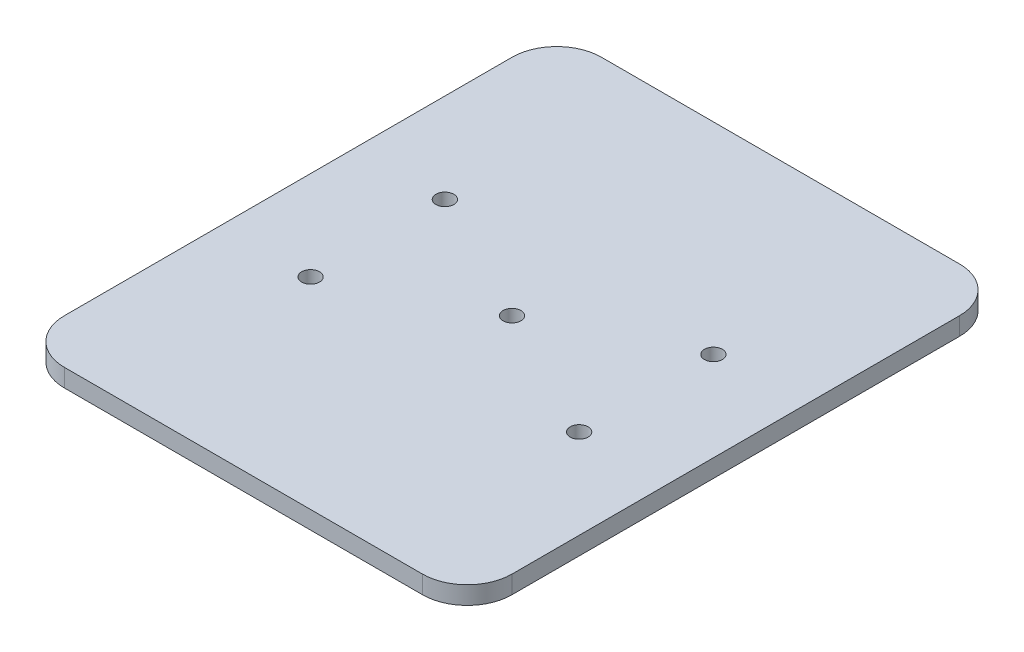
from build123d import *

# Parameters (mm, degrees)
SKETCH1_R           = 1
BOSS_EXTRUDE1_DEPTH = 2


with BuildPart() as part:
    # Sketch1 → Boss-Extrude1 (new body)
    with BuildSketch(Plane(origin=(0, 0, 0), x_dir=(1, 0, 0), z_dir=(0, 1, 0))):
        with BuildLine():
            Line((-52.254901961, 26.274509804), (-12.254901961, 26.274509804))
            ThreePointArc((-12.254901961, 26.274509804), (-8.719368055, 24.81004371), (-7.254901961, 21.274509804))
            Line((-7.254901961, 21.274509804), (-7.254901961, -28.725490196))
            ThreePointArc((-7.254901961, -28.725490196), (-8.719368055, -32.261024102), (-12.254901961, -33.725490196))
            Line((-12.254901961, -33.725490196), (-52.254901961, -33.725490196))
            ThreePointArc((-52.254901961, -33.725490196), (-55.790435867, -32.261024102), (-57.254901961, -28.725490196))
            Line((-57.254901961, -28.725490196), (-57.254901961, 21.274509804))
            ThreePointArc((-57.254901961, 21.274509804), (-55.790435867, 24.81004371), (-52.254901961, 26.274509804))
        make_face()
        with Locations(Location((-32.254901961, -3.725490196, 0), (0, 0, 270))):
            Circle(SKETCH1_R, mode=Mode.SUBTRACT)
        with Locations(Location((-47.254901961, 3.774509804, 0), (0, 0, 270))):
            Circle(SKETCH1_R, mode=Mode.SUBTRACT)
        with Locations(Location((-47.254901961, -11.225490196, 0), (0, 0, 270))):
            Circle(SKETCH1_R, mode=Mode.SUBTRACT)
        with Locations(Location((-17.254901961, 3.774509804, 0), (0, 0, 270))):
            Circle(SKETCH1_R, mode=Mode.SUBTRACT)
        with Locations(Location((-17.254901961, -11.225490196, 0), (0, 0, 270))):
            Circle(SKETCH1_R, mode=Mode.SUBTRACT)
    extrude(amount=BOSS_EXTRUDE1_DEPTH)


solid = part.part
